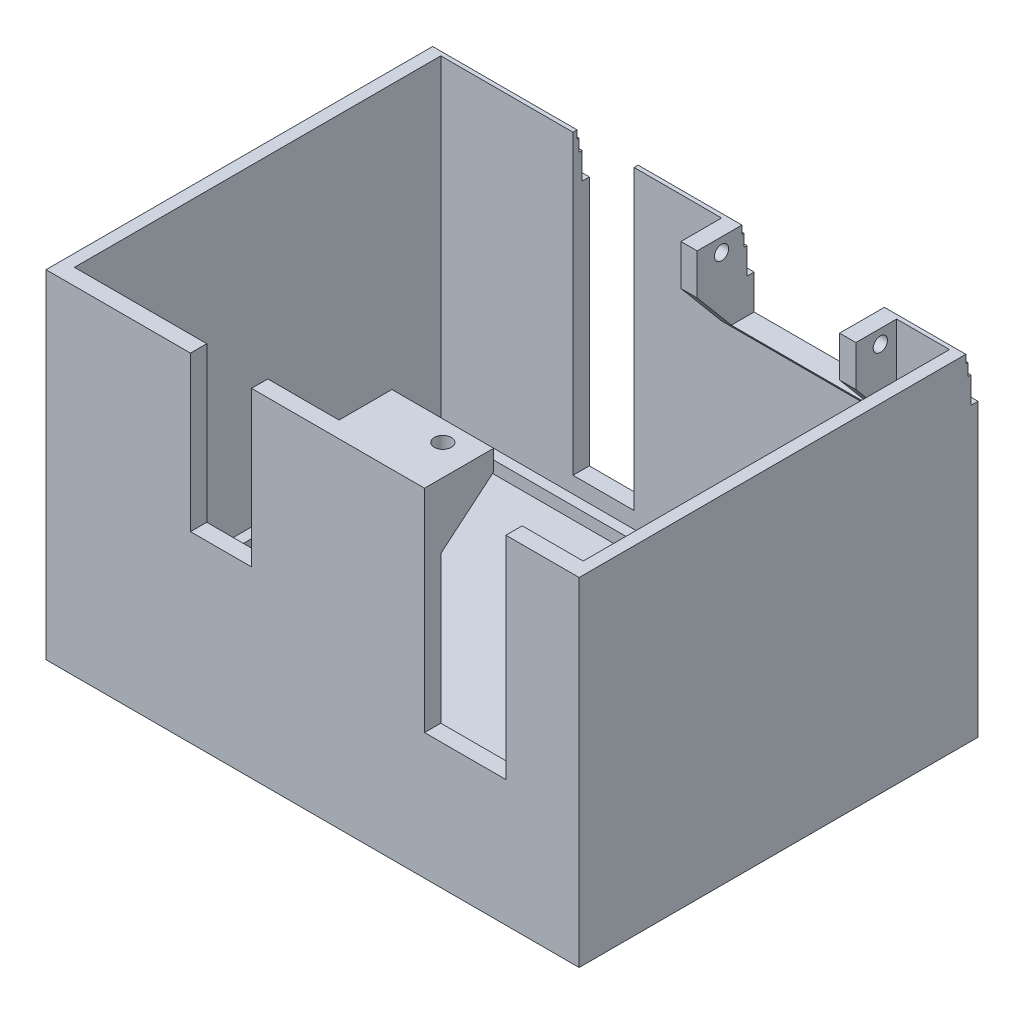
from build123d import *

# Parameters (mm, degrees)
SKETCH1_W                       = 131
SKETCH1_H                       = 98
SKETCH1_W_2                     = 125
SKETCH1_H_2                     = 90
BOSS_EXTRUDE1_DEPTH             = 80
SKETCH2_W                       = 131
SKETCH2_H                       = 98
BOSS_EXTRUDE2_DEPTH             = 3
SKETCH4_W                       = 125
SKETCH4_H                       = 90
SKETCH4_W_2                     = 119.5
SKETCH4_H_2                     = 84.5
BOSS_EXTRUDE3_DEPTH             = 3
SKETCH5_W                       = 15
SKETCH5_H                       = 73
CABLE_CUT_TOP_DEPTH             = 4
CABLE_CUT_BOTTOM_RIGHT_REACH    = 141.736
SKETCH6_W                       = 20
SKETCH6_H                       = 52
SKETCH10_W                      = 15
SKETCH10_H                      = 38
CABLE_CUT_BOTTOM_LEFT_DEPTH     = 4
SCHANIER_CUT_REACH              = 141.736
SKETCH7_W                       = 35
SKETCH7_H                       = 20
SKETCH8_W                       = 4
SKETCH8_H                       = 10
SCHANIER_DEPTH                  = 10
F_3D_PRINTER_SUPPORT_DEPTH      = 43
SKIZZE3_W                       = 35
SKIZZE3_H                       = 10
SCHNITT_LINEAR_AUSTRAGEN1_DEPTH = 20
SCHNITT_LINEAR_AUSTRAGEN3_REACH = 120.258
SKIZZE5_R                       = 1.75
AUFSATZ_LINEAR_AUSTRAGEN2_DEPTH = 25
SCHNITT_LINEAR_AUSTRAGEN4_REACH = 118.534
SKIZZE10_R                      = 2.1
CUT_EXTRUDE4_REACH              = 163.127


with BuildPart() as part:
    # Sketch1 → Boss-Extrude1 (new body)
    with BuildSketch(Plane(origin=(0, 0, 0), x_dir=(1, 0, 0), z_dir=(0, 1, 0))):
        Rectangle(SKETCH1_W, SKETCH1_H)
        Rectangle(SKETCH1_W_2, SKETCH1_H_2, mode=Mode.SUBTRACT)
    extrude(amount=BOSS_EXTRUDE1_DEPTH)

    # Sketch2 → Boss-Extrude2 (add)
    with BuildSketch(Plane.XZ):
        Rectangle(SKETCH2_W, SKETCH2_H)
    extrude(amount=BOSS_EXTRUDE2_DEPTH)

    # Sketch4 → Boss-Extrude3 (add)
    with BuildSketch(Plane(origin=(0, 0, 0), x_dir=(1, 0, 0), z_dir=(0, 1, 0))):
        Rectangle(SKETCH4_W, SKETCH4_H)
        with Locations((-0.25, 0.25)):
            Rectangle(SKETCH4_W_2, SKETCH4_H_2, mode=Mode.SUBTRACT)
    extrude(amount=BOSS_EXTRUDE3_DEPTH)

    # Sketch5 → Cable Cut Top (cut)
    with BuildSketch(Plane(origin=(0, 0, -49), x_dir=(-1, 0, 0), z_dir=(0, 0, -1))):
        with Locations((22.5, 43.5)):
            Rectangle(SKETCH5_W, SKETCH5_H)
    extrude(amount=-CABLE_CUT_TOP_DEPTH, mode=Mode.SUBTRACT)

    # Sketch6 → Cable Cut Bottom Right (cut, up to next)
    with BuildSketch(Plane(origin=(0, 0, 45), x_dir=(-1, 0, 0), z_dir=(0, 0, -1)), mode=Mode.PRIVATE) as cable_cut_bottom_right_sk1:
        with Locations((-37.5, 54)):
            Rectangle(SKETCH6_W, SKETCH6_H)
    cable_cut_bottom_right_tool1 = extrude(cable_cut_bottom_right_sk1.sketch, amount=-CABLE_CUT_BOTTOM_RIGHT_REACH, mode=Mode.PRIVATE) & part.part
    add(cable_cut_bottom_right_tool1.solids().sort_by_distance((37.5, 54, 45))[0], mode=Mode.SUBTRACT)

    # Sketch10 → Cable Cut Bottom Left (cut)
    with BuildSketch(Plane.XY.offset(49)):
        with Locations((-22.5, 61)):
            Rectangle(SKETCH10_W, SKETCH10_H)
    extrude(amount=-CABLE_CUT_BOTTOM_LEFT_DEPTH, mode=Mode.SUBTRACT)

    # Sketch7 → Schanier Cut (cut, up to next)
    with BuildSketch(Plane.XY.offset(-45), mode=Mode.PRIVATE) as schanier_cut_sk1:
        with Locations((28, 70)):
            Rectangle(SKETCH7_W, SKETCH7_H)
    schanier_cut_tool1 = extrude(schanier_cut_sk1.sketch, amount=-SCHANIER_CUT_REACH, mode=Mode.PRIVATE) & part.part
    add(schanier_cut_tool1.solids().sort_by_distance((28, 70, -45))[0], mode=Mode.SUBTRACT)

    # Sketch8 → Schanier (add)
    with BuildSketch(Plane.XY.offset(-45)):
        with Locations((8.5, 75)):
            Rectangle(SKETCH8_W, SKETCH8_H)
        with Locations((47.5, 75)):
            Rectangle(SKETCH8_W, SKETCH8_H)
    extrude(amount=SCHANIER_DEPTH)

    # Skizze2 → 3D Printer Support (add)
    with BuildSketch(Plane.ZY.offset(-6.5)):
        Polygon((-35, 70), (-45, 70), (-45, 58.082464074), align=None)
    extrude(amount=-F_3D_PRINTER_SUPPORT_DEPTH)

    # Skizze3 → Schnitt-Linear austragen1 (cut)
    with BuildSketch(Plane(origin=(0, 0, -45), x_dir=(-1, 0, 0), z_dir=(0, 0, -1))):
        with Locations((-28, 65)):
            Rectangle(SKIZZE3_W, SKIZZE3_H)
    extrude(amount=-SCHNITT_LINEAR_AUSTRAGEN1_DEPTH, mode=Mode.SUBTRACT)

    # Schnitt-Linear austragen3: up to this face of the body (flat: up to its plane)
    schnitt_linear_austragen3_end = Plane(part.part.faces().sort_by_distance((49.5, 71.649796712, -40.622308687))[0])
    # Skizze5 → Schnitt-Linear austragen3 (cut, up to the picked face)
    with BuildSketch(Plane.ZY.offset(-6.5), mode=Mode.PRIVATE) as schnitt_linear_austragen3_sk1:
        with Locations((-41, 76.645898034)):
            Circle(SKIZZE5_R)
    schnitt_linear_austragen3_tool1 = split(extrude(schnitt_linear_austragen3_sk1.sketch, amount=-SCHNITT_LINEAR_AUSTRAGEN3_REACH, mode=Mode.PRIVATE), bisect_by=schnitt_linear_austragen3_end, keep=Keep.BOTH, mode=Mode.PRIVATE)
    add(schnitt_linear_austragen3_tool1.solids().sort_by(Axis((6.5, 76.645898, -41), (1, 0, 0)))[0], mode=Mode.SUBTRACT)

    # Skizze9 → Aufsatz-Linear austragen2 (add)
    with BuildSketch(Plane(origin=(27.5, 0, 0), x_dir=(0, 0, -1), z_dir=(1, 0, 0))):
        Polygon((-45, 80), (-32, 80), (-32, 75), (-45, 64.091704795), align=None)
    extrude(amount=-AUFSATZ_LINEAR_AUSTRAGEN2_DEPTH)

    # Schnitt-Linear austragen4: up to this plane
    schnitt_linear_austragen4_end = Plane(origin=(2.5, 75, 32), z_dir=(0, -0.766044443118974, -0.6427876096865441))
    # Skizze10 → Schnitt-Linear austragen4 (cut, up to the surface)
    with BuildSketch(Plane(origin=(0, 80, 0), x_dir=(1, 0, 0), z_dir=(0, 1, 0)), mode=Mode.PRIVATE) as schnitt_linear_austragen4_sk1:
        with Locations(Location((20, -37, 0), (0, 0, 270))):
            Circle(SKIZZE10_R)
    schnitt_linear_austragen4_tool1 = split(extrude(schnitt_linear_austragen4_sk1.sketch, amount=-SCHNITT_LINEAR_AUSTRAGEN4_REACH, mode=Mode.PRIVATE), bisect_by=schnitt_linear_austragen4_end, keep=Keep.BOTH, mode=Mode.PRIVATE)
    add(schnitt_linear_austragen4_tool1.solids().sort_by_distance((20, 80, 37))[0], mode=Mode.SUBTRACT)

    # Cut-Extrude4: up to this face of the body (flat: up to its plane)
    cut_extrude4_end = Plane(part.part.faces().sort_by_distance((65.5, 38.5, 0))[0])
    # Sketch9 → Cut-Extrude4 (cut, up to the picked face)
    with BuildSketch(Plane.ZY.offset(65.5), mode=Mode.PRIVATE) as cut_extrude4_sk1:
        Polygon((-46, 78), (-46.5, 78), (-46.5, 75), (-47.25, 75), (-47.25, 68.5), (-49, 68.5), (-49, 80), (-46, 80), align=None)
    cut_extrude4_tool1 = split(extrude(cut_extrude4_sk1.sketch, amount=-CUT_EXTRUDE4_REACH, mode=Mode.PRIVATE), bisect_by=cut_extrude4_end, keep=Keep.BOTH, mode=Mode.PRIVATE)
    add(cut_extrude4_tool1.solids().sort_by(Axis((-65.5, 74.930905, -47.861181), (1, 0, 0)))[0], mode=Mode.SUBTRACT)


solid = part.part
